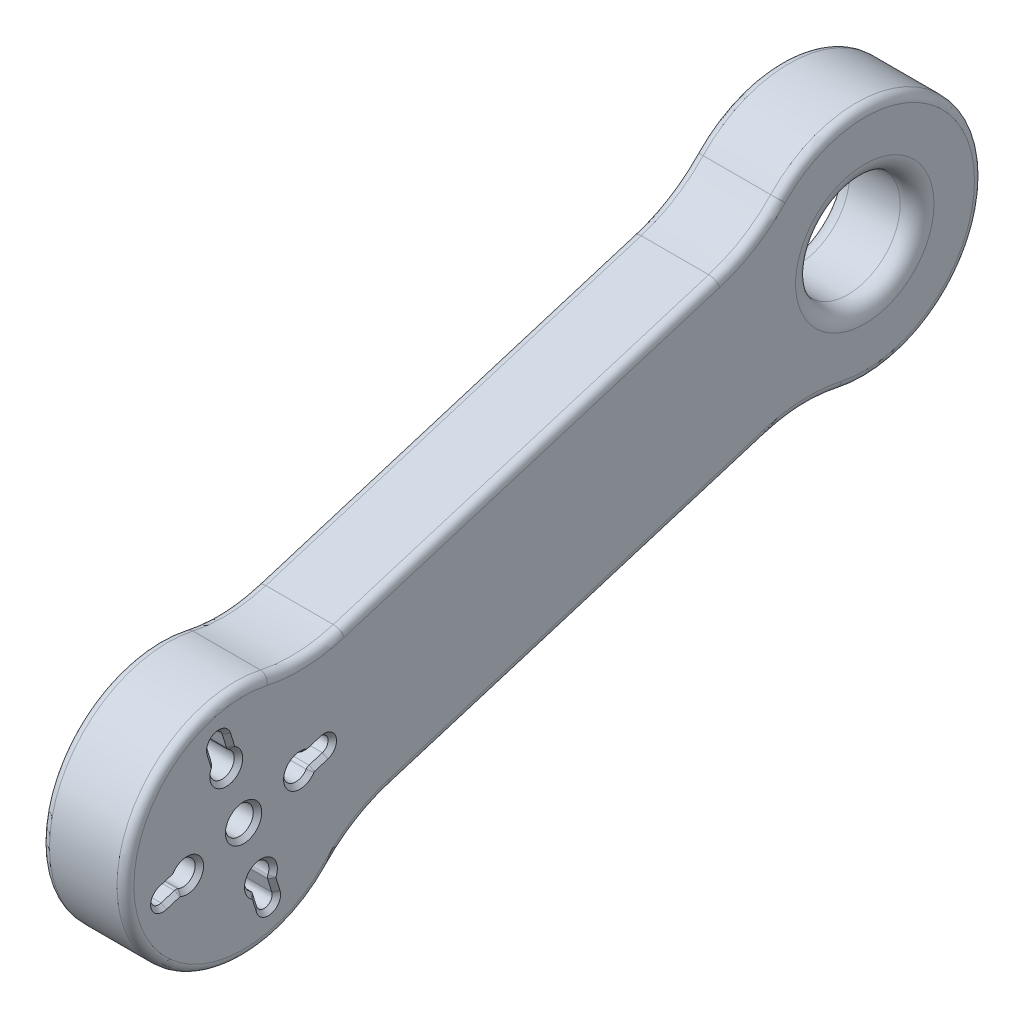
from build123d import *

# Parameters (mm, degrees)
SKETCH3_R           = 6.2
SKETCH3_R_2         = 1.65
BOSS_EXTRUDE2_DEPTH = 10
FILLET2_R           = 1
FILLET3_R           = 2
CHAMFER1_SIZE       = 0.5


with BuildPart() as part:
    # Sketch3 → Boss-Extrude2 (new body)
    with BuildSketch(Plane.YZ):
        with BuildLine():
            Line((73.512921579, -24.484279325), (59.860392755, 20.00495784))
            ThreePointArc((59.860392755, 20.00495784), (58.060622606, 23.969403294), (55.312907294, 27.346689321))
            ThreePointArc((55.312907294, 27.346689321), (60.844726413, 50.883986018), (78.626947453, 34.501129936))
            ThreePointArc((78.626947453, 34.501129936), (78.246597772, 30.163926405), (78.980372781, 25.872356228))
            Line((78.980372781, 25.872356228), (92.632901604, -18.616880937))
            ThreePointArc((92.632901604, -18.616880937), (94.432671754, -22.581326391), (97.180387066, -25.958612418))
            ThreePointArc((97.180387066, -25.958612418), (91.648567947, -49.495909114), (73.866346907, -33.113053032))
            ThreePointArc((73.866346907, -33.113053032), (74.246696587, -28.775849502), (73.512921579, -24.484279325))
        make_face()
        with Locations(Location((87.541389076, -36.111923097, 0), (0, 0, 270))):
            Circle(SKETCH3_R, mode=Mode.SUBTRACT)
        with Locations(Location((64.951905284, 37.5, 0), (0, 0, 270))):
            Circle(SKETCH3_R_2, mode=Mode.SUBTRACT)
        with BuildLine():
            Line((66.977405426, 27.661308564), (66.490892718, 29.246698316))
            ThreePointArc((66.490892718, 29.246698316), (66.393310842, 29.435926026), (66.235791288, 29.579163377))
            ThreePointArc((66.235791288, 29.579163377), (66.580108336, 32.194205543), (68.331993977, 30.22243059))
            ThreePointArc((68.331993977, 30.22243059), (68.281933632, 30.015492652), (68.30729082, 29.804101163))
            Line((68.30729082, 29.804101163), (68.793803529, 28.218711411))
            ThreePointArc((68.793803529, 28.218711411), (68.164305901, 27.031810936), (66.977405426, 27.661308564))
        make_face(mode=Mode.SUBTRACT)
        with BuildLine():
            Line((55.670616695, 33.658101755), (57.256006447, 34.144614464))
            ThreePointArc((57.256006447, 34.144614464), (57.467397936, 34.169971652), (57.674335874, 34.119911307))
            ThreePointArc((57.674335874, 34.119911307), (59.646110827, 35.871796947), (57.031068661, 36.216113995))
            ThreePointArc((57.031068661, 36.216113995), (56.88783131, 36.058594441), (56.6986036, 35.961012566))
            Line((56.6986036, 35.961012566), (55.113213848, 35.474499857))
            ThreePointArc((55.113213848, 35.474499857), (54.48371622, 34.287599383), (55.670616695, 33.658101755))
        make_face(mode=Mode.SUBTRACT)
        with BuildLine():
            Line((61.110007039, 46.781288589), (61.596519748, 45.195898837))
            ThreePointArc((61.596519748, 45.195898837), (61.621876936, 44.984507348), (61.571816591, 44.77756941))
            ThreePointArc((61.571816591, 44.77756941), (63.323702231, 42.805794457), (63.668019279, 45.420836623))
            ThreePointArc((63.668019279, 45.420836623), (63.510499725, 45.564073974), (63.41291785, 45.753301684))
            Line((63.41291785, 45.753301684), (62.926405141, 47.338691436))
            ThreePointArc((62.926405141, 47.338691436), (61.739504667, 47.968189064), (61.110007039, 46.781288589))
        make_face(mode=Mode.SUBTRACT)
        with BuildLine():
            Line((74.233193873, 41.341898245), (72.647804121, 40.855385536))
            ThreePointArc((72.647804121, 40.855385536), (72.436412632, 40.830028348), (72.229474693, 40.880088693))
            ThreePointArc((72.229474693, 40.880088693), (70.257699741, 39.128203053), (72.872741907, 38.783886005))
            ThreePointArc((72.872741907, 38.783886005), (73.015979258, 38.941405559), (73.205206968, 39.038987434))
            Line((73.205206968, 39.038987434), (74.79059672, 39.525500143))
            ThreePointArc((74.79059672, 39.525500143), (75.420094348, 40.712400617), (74.233193873, 41.341898245))
        make_face(mode=Mode.SUBTRACT)
    extrude(amount=BOSS_EXTRUDE2_DEPTH)

    # Fillet2
    fillet2_edges = [part.edges().sort_by_distance(p)[0] for p in [
        (0, 66.686657167, -2.239660742),
        (0, 58.060622606, 23.969403294),
        (0, 60.844726413, 50.883986018),
        (0, 78.246597772, 30.163926405),
        (10, 58.060622606, 23.969403294),
        (10, 66.686657167, -2.239660742),
        (10, 74.246696587, -28.775849502),
        (10, 91.648567947, -49.495909114),
        (10, 94.432671754, -22.581326391),
        (10, 85.806637192, 3.627737645),
        (10, 78.246597772, 30.163926405),
        (0, 85.806637192, 3.627737645),
        (10, 60.844726413, 50.883986018),
        (0, 94.432671754, -22.581326391),
        (0, 91.648567947, -49.495909114),
        (0, 74.246696587, -28.775849502),
    ]]
    fillet(fillet2_edges, radius=FILLET2_R)

    # Fillet3
    fillet3_edges = [part.edges().sort_by_distance(p)[0] for p in [
        (0, 87.541389076, -29.911923097),
        (10, 87.541389076, -29.911923097),
    ]]
    fillet(fillet3_edges, radius=FILLET3_R)

    # Chamfer1
    chamfer1_edges = [part.edges().sort_by_distance(p)[0] for p in [
        (0, 68.164305901, 27.031810936),
        (0, 68.550547174, 29.011406287),
        (0, 68.281933632, 30.015492652),
        (0, 66.580108336, 32.194205543),
        (0, 66.393310842, 29.435926026),
        (0, 66.734149072, 28.45400344),
        (10, 68.164305901, 27.031810936),
        (10, 68.550547174, 29.011406287),
        (10, 68.281933632, 30.015492652),
        (10, 66.580108336, 32.194205543),
        (10, 66.393310842, 29.435926026),
        (10, 66.734149072, 28.45400344),
        (0, 64.951905284, 39.15),
        (10, 64.951905284, 39.15),
        (0, 54.48371622, 34.287599383),
        (0, 56.463311571, 33.901358109),
        (0, 57.467397936, 34.169971652),
        (0, 59.646110827, 35.871796947),
        (0, 56.88783131, 36.058594441),
        (0, 55.905908724, 35.717756212),
        (10, 54.48371622, 34.287599383),
        (10, 56.463311571, 33.901358109),
        (10, 57.467397936, 34.169971652),
        (10, 59.646110827, 35.871796947),
        (10, 56.88783131, 36.058594441),
        (10, 55.905908724, 35.717756212),
        (0, 61.739504667, 47.968189064),
        (0, 61.353263393, 45.988593713),
        (0, 61.621876936, 44.984507348),
        (0, 63.323702231, 42.805794457),
        (0, 63.510499725, 45.564073974),
        (0, 63.169661496, 46.54599656),
        (10, 61.739504667, 47.968189064),
        (10, 61.353263393, 45.988593713),
        (10, 61.621876936, 44.984507348),
        (10, 63.323702231, 42.805794457),
        (10, 63.510499725, 45.564073974),
        (10, 63.169661496, 46.54599656),
        (0, 75.420094348, 40.712400617),
        (0, 73.440498997, 41.098641891),
        (0, 72.436412632, 40.830028348),
        (0, 70.257699741, 39.128203053),
        (0, 73.015979258, 38.941405559),
        (0, 73.997901844, 39.282243788),
        (10, 75.420094348, 40.712400617),
        (10, 73.440498997, 41.098641891),
        (10, 72.436412632, 40.830028348),
        (10, 70.257699741, 39.128203053),
        (10, 73.015979258, 38.941405559),
        (10, 73.997901844, 39.282243788),
    ]]
    chamfer(chamfer1_edges, length=CHAMFER1_SIZE)


solid = part.part
